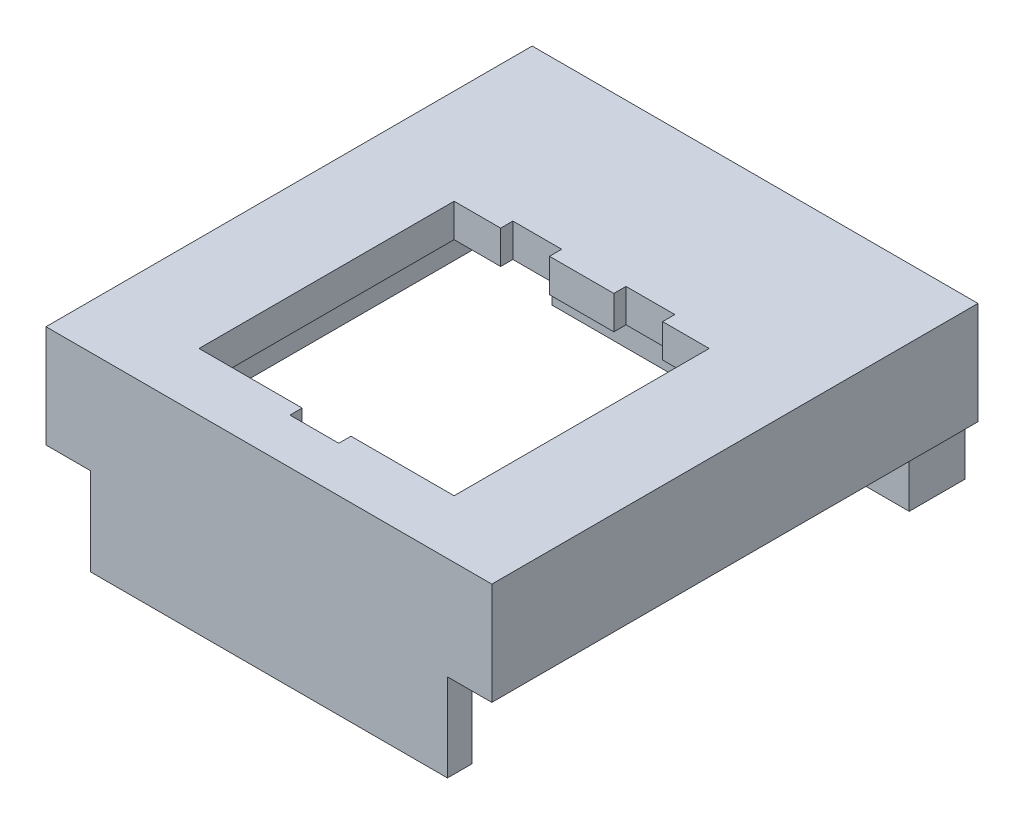
from build123d import *

# Parameters (mm, degrees)
SKETCH1_W               = 2
SKETCH1_H               = 20.42
BOSS_EXTRUDE1_DEPTH     = 4.62
BOSS_EXTRUDE1_2_DEPTH   = 4.62
SKETCH2_W               = 16.1
SKETCH2_H               = 1.1
BOSS_EXTRUDE2_DEPTH     = 8.57
SKETCH3_W               = 20.1
SKETCH3_H               = 1.5
BOSS_EXTRUDE3_DEPTH     = 4.62
SKETCH4_W               = 16.1
SKETCH4_H               = 1.5
BOSS_EXTRUDE4_DEPTH     = 3.95
SKETCH5_W               = 19.32
SKETCH5_H               = 1.5
BOSS_EXTRUDE5_DEPTH     = 16.1
SKETCH6_W               = 11.5
SKETCH6_H               = 11.5
CUT_EXTRUDE1_DEPTH      = 18.651388047
SKETCH8_W               = 2.2
SKETCH8_H               = 0.55
CUT_EXTRUDE2_DEPTH      = 3.95
SKETCH10_W              = 8.121119636
SKETCH10_H              = 3.071119636
CUT_EXTRUDE3_DEPTH      = 1.5
SKETCH11_W              = 16.1
SKETCH11_H              = 2.3
BOSS_EXTRUDE6_DEPTH     = 2.08
CUT_EXTRUDE5_START      = -7.07
SKETCH12_W              = 16.1
SKETCH12_H              = 0.4
CUT_EXTRUDE5_DEPTH      = 7.07
CUT_EXTRUDE6_DEPTH      = 24.21892547
CUT_EXTRUDE6_DEPTH_BACK = 24.21892547
SKETCH13_W              = 0.2
SKETCH13_H              = 2.3
SKETCH14_W              = 0.474033505
SKETCH14_H              = 2.3
CUT_EXTRUDE8_DEPTH      = 24.100703452


with BuildPart() as part:
    # Sketch1 → Boss-Extrude1 (new body)
    with BuildSketch(Plane(origin=(0, 0, 0), x_dir=(1, 0, 0), z_dir=(0, 1, 0))):
        with Locations((-9.05, 0)):
            Rectangle(SKETCH1_W, SKETCH1_H)
    extrude(amount=BOSS_EXTRUDE1_DEPTH)



with BuildPart() as body_2:
    # Sketch1 → Boss-Extrude1 2 (new body)
    with BuildSketch(Plane(origin=(0, 0, 0), x_dir=(1, 0, 0), z_dir=(0, 1, 0))):
        with Locations((9.05, 0)):
            Rectangle(SKETCH1_W, SKETCH1_H)
    extrude(amount=BOSS_EXTRUDE1_2_DEPTH)


with BuildPart() as part_1:
    add(part.part)

    add(body_2.part)  # Boss-Extrude2 merges body 2
    # Sketch2 → Boss-Extrude2 (add)
    with BuildSketch(Plane(origin=(0, 4.62, 0), x_dir=(1, 0, 0), z_dir=(0, 1, 0))):
        with Locations((0, -9.66)):
            Rectangle(SKETCH2_W, SKETCH2_H)
    extrude(amount=-BOSS_EXTRUDE2_DEPTH)

    # Sketch3 → Boss-Extrude3 (add)
    with BuildSketch(Plane(origin=(0, 4.62, 0), x_dir=(1, 0, 0), z_dir=(0, 1, 0))):
        with Locations((0, 10.96)):
            Rectangle(SKETCH3_W, SKETCH3_H)
    extrude(amount=-BOSS_EXTRUDE3_DEPTH)

    # Sketch4 → Boss-Extrude4 (add)
    with BuildSketch(Plane.XZ):
        with Locations((0, -10.96)):
            Rectangle(SKETCH4_W, SKETCH4_H)
    extrude(amount=BOSS_EXTRUDE4_DEPTH)

    # Sketch5 → Boss-Extrude5 (add)
    with BuildSketch(Plane(origin=(-8.05, 0, 0), x_dir=(0, 0, -1), z_dir=(1, 0, 0))):
        with Locations((0.55, 3.87)):
            Rectangle(SKETCH5_W, SKETCH5_H)
    extrude(amount=BOSS_EXTRUDE5_DEPTH)

    # Sketch6 → Cut-Extrude1 (cut, through all)
    with BuildSketch(Plane(origin=(0, 4.62, 0), x_dir=(1, 0, 0), z_dir=(0, 1, 0))):
        with Locations((0, -1.86)):
            Rectangle(SKETCH6_W, SKETCH6_H)
    extrude(amount=-CUT_EXTRUDE1_DEPTH, mode=Mode.SUBTRACT)

    # Sketch8 → Cut-Extrude2 (cut)
    with BuildSketch(Plane(origin=(0, 4.62, 0), x_dir=(1, 0, 0), z_dir=(0, 1, 0))):
        with Locations((0, -7.885)):
            Rectangle(SKETCH8_W, SKETCH8_H)
        with Locations((-2.55, 4.165)):
            Rectangle(SKETCH8_W, SKETCH8_H)
        with Locations((2.55, 4.165)):
            Rectangle(SKETCH8_W, SKETCH8_H)
    extrude(amount=-CUT_EXTRUDE2_DEPTH, mode=Mode.SUBTRACT)

    # Sketch10 → Cut-Extrude3 (cut)
    with BuildSketch(Plane(origin=(0, 0, -11.71), x_dir=(-1, 0, 0), z_dir=(0, 0, -1))):
        with Locations((0.420559818, 0.564440182)):
            Rectangle(SKETCH10_W, SKETCH10_H)
    extrude(amount=-CUT_EXTRUDE3_DEPTH, mode=Mode.SUBTRACT)

    # Sketch11 → Boss-Extrude6 (add)
    with BuildSketch(Plane(origin=(0, 0, -11.71), x_dir=(-1, 0, 0), z_dir=(0, 0, -1))):
        with Locations((0, -2.8)):
            Rectangle(SKETCH11_W, SKETCH11_H)
    extrude(amount=BOSS_EXTRUDE6_DEPTH)

    # Sketch12 → Cut-Extrude5 (cut)
    with BuildSketch(Plane.XZ.offset(3.95).offset(CUT_EXTRUDE5_START)):
        with Locations((0, -10.41)):
            Rectangle(SKETCH12_W, SKETCH12_H)
    extrude(amount=CUT_EXTRUDE5_DEPTH, mode=Mode.SUBTRACT)

    # Sketch13 → Cut-Extrude6 (cut, two sides: drawn at the far end of the back side and taken through both)
    with BuildSketch(Plane.ZY.offset(8.05).offset(-CUT_EXTRUDE6_DEPTH_BACK)):
        with Locations((-13.69, -2.8)):
            Rectangle(SKETCH13_W, SKETCH13_H)
    extrude(amount=CUT_EXTRUDE6_DEPTH + CUT_EXTRUDE6_DEPTH_BACK, mode=Mode.SUBTRACT)

    # Sketch14 → Cut-Extrude8 (cut, through all)
    with BuildSketch(Plane.ZY.offset(8.05)):
        with Locations((-13.352983248, -2.8)):
            Rectangle(SKETCH14_W, SKETCH14_H)
    extrude(amount=-CUT_EXTRUDE8_DEPTH, mode=Mode.SUBTRACT)


solid = part_1.part
